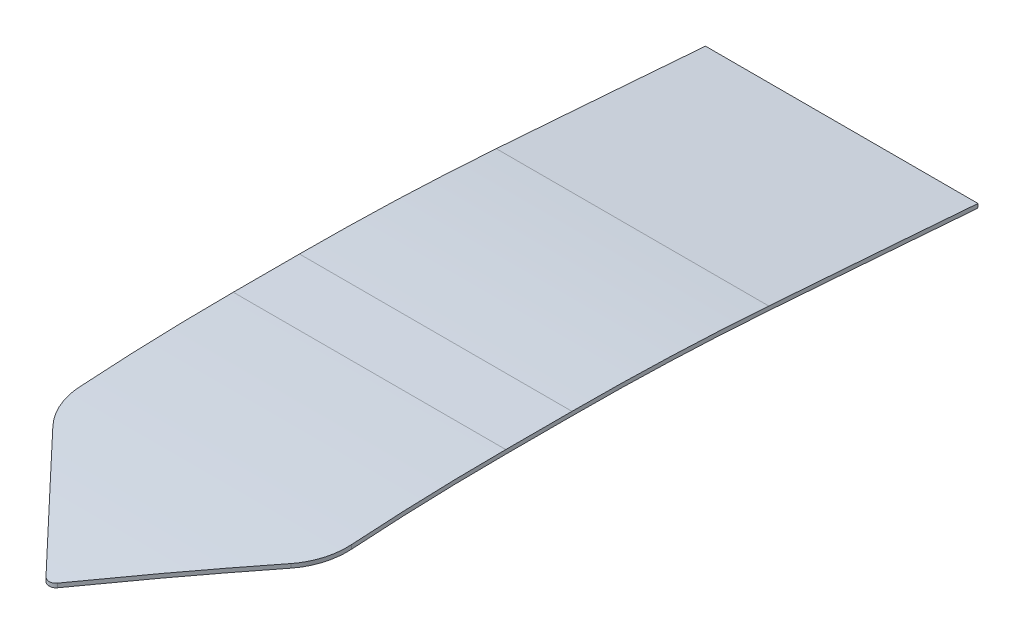
from build123d import *

# Parameters (mm, degrees)
BOSS_EXTRUDE1_DEPTH      = 1562
BOSS_EXTRUDE1_DEPTH_BACK = 176
SKETCH2_W                = 3363.575860712
SKETCH2_H                = 5970.454949978
CUT_EXTRUDE2_DEPTH       = 6472


with BuildPart() as part:
    # Sketch1 → Boss-Extrude1 (new, two sides: drawn at the far end of the back side and taken through both)
    with BuildSketch(Plane(origin=(221.223204368, 2174.889348435, 3089.353639068), x_dir=(0, 0, -1), z_dir=(1, 0, 0)).offset(-BOSS_EXTRUDE1_DEPTH_BACK)):
        with BuildLine():
            Line((418.470256952, 343.848259545), (835.79936838, 343.848259545))
            ThreePointArc((835.79936838, 343.848259545), (1134.545393582, 341.22748792), (1433.199462208, 333.365979742))
            ThreePointArc((1433.199462208, 333.365979742), (1566.571910766, 328.160677129), (1699.899462208, 321.910138249))
            ThreePointArc((1699.899462208, 321.910138249), (1888.304064269, 311.290467655), (2076.579417193, 298.58365992))
            ThreePointArc((2076.579417193, 298.58365992), (2736.086325953, 249.582434707), (3395.470256952, 198.953250272))
            Line((3395.470256952, 198.953250272), (3393.494444982, 173.63021398))
            ThreePointArc((3393.494444982, 173.63021398), (2734.173034363, 224.25459794), (2074.728657642, 273.251177036))
            ThreePointArc((2074.728657642, 273.251177036), (1886.73413806, 285.939031173), (1698.61056213, 296.542861364))
            ThreePointArc((1698.61056213, 296.542861364), (1565.481883357, 302.784076879), (1432.308374436, 307.981615212))
            ThreePointArc((1432.308374436, 307.981615212), (1134.099781114, 315.831397088), (835.79936838, 318.448259545))
            Line((835.79936838, 318.448259545), (418.470256952, 318.448259545))
            ThreePointArc((418.470256952, 318.448259545), (-593.226075755, 283.125851814), (-1599.995422374, 177.330649619))
            Line((-1599.995422374, 177.330649619), (-1603.529743048, 202.483553574))
            ThreePointArc((-1603.529743048, 202.483553574), (-594.997549653, 308.464002501), (418.470256952, 343.848259545))
        make_face()
    extrude(amount=BOSS_EXTRUDE1_DEPTH + BOSS_EXTRUDE1_DEPTH_BACK)

    # Sketch2 → Cut-Extrude2 (cut)
    with BuildSketch(Plane(origin=(0, 0, 0), x_dir=(1, 0, 0), z_dir=(0, 1, 0))):
        with Locations((788.511086427, -1905.513066648)):
            Rectangle(SKETCH2_W, SKETCH2_H)
        with BuildLine():
            Line((950.602387574, -4674.184330052), (1664.256670016, -3917.290965599))
            ThreePointArc((1664.256670016, -3917.290965599), (1744.984812296, -3790.508945182), (1773.223204368, -3642.883382116))
            Line((1773.223204368, -3642.883382116), (1773.223204368, 306.116617884))
            Line((1773.223204368, 306.116617884), (55.223204368, 306.116617884))
            Line((55.223204368, 306.116617884), (55.223204368, -3642.883382116))
            ThreePointArc((55.223204368, -3642.883382116), (83.461596439, -3790.508945182), (164.18973872, -3917.290965599))
            Line((164.18973872, -3917.290965599), (877.844021162, -4674.184330052))
            ThreePointArc((877.844021162, -4674.184330052), (914.223204368, -4689.883382116), (950.602387574, -4674.184330052))
        make_face(mode=Mode.SUBTRACT)
    extrude(amount=CUT_EXTRUDE2_DEPTH, mode=Mode.SUBTRACT)


solid = part.part
